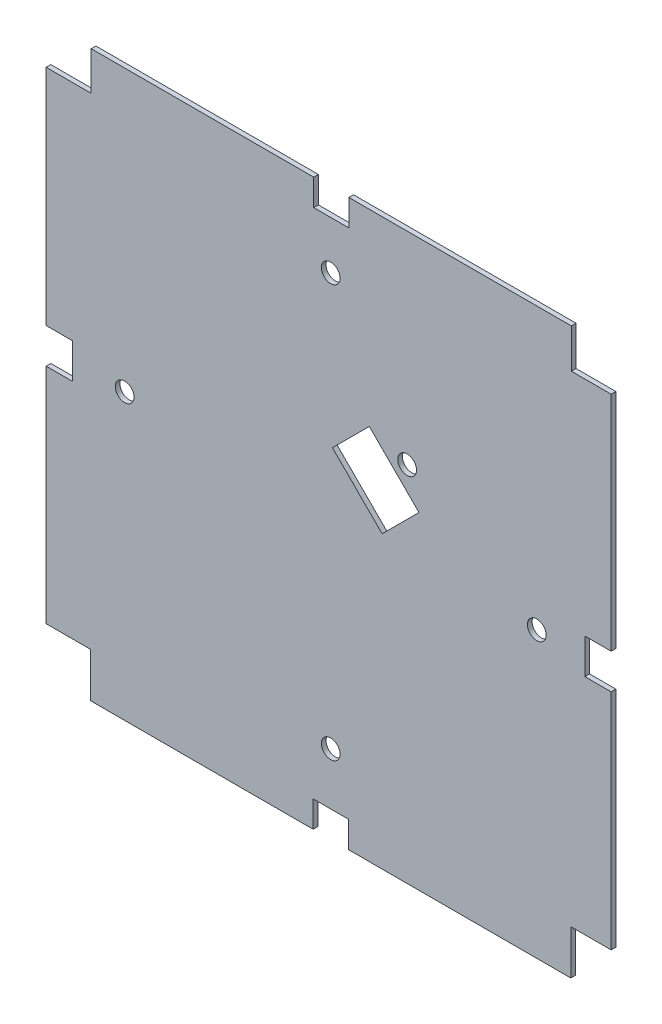
from build123d import *

# Parameters (mm, degrees)
SKETCH1_R           = 1.6
BOSS_EXTRUDE1_DEPTH = 0.8
CUT_EXTRUDE1_DEPTH  = 0.8


with BuildPart() as part:
    # Sketch1 → Boss-Extrude1 (new body)
    with BuildSketch(Plane.XY):
        Polygon((-21.328326925, 35.64702685), (-59.328326925, 35.64702685), (-59.328326925, 29.04702685), (-67.028326925, 29.04702685), (-67.028326925, -9.15297315), (-62.528326925, -9.15297315), (-62.528326925, -15.15297315), (-67.028326925, -15.15297315), (-67.028326925, -53.25297315), (-59.428326925, -53.25297315), (-59.428326925, -60.85297315), (-21.428326925, -60.85297315), (-21.428326925, -56.35297315), (-15.428326925, -56.35297315), (-15.428326925, -60.85297315), (22.571673075, -60.85297315), (22.571673075, -53.25297315), (29.471673075, -53.25297315), (29.471673075, -15.073036827), (24.971673075, -15.073036827), (24.971673075, -9.073036827), (29.471673075, -9.073036827), (29.471673075, 28.94702685), (22.671673075, 28.94702685), (22.671673075, 35.64702685), (-15.328326925, 35.64702685), (-15.328326925, 31.14702685), (-21.328326925, 31.14702685), align=None)
        with Locations((-18.428147066, -47.449600232)):
            Circle(SKETCH1_R, mode=Mode.SUBTRACT)
        with Locations((-53.624954006, -12.252793292)):
            Circle(SKETCH1_R, mode=Mode.SUBTRACT)
        with Locations((-5.370945752, 1.09702685)):
            Circle(SKETCH1_R, mode=Mode.SUBTRACT)
        with Locations((16.768659873, -12.252793292)):
            Circle(SKETCH1_R, mode=Mode.SUBTRACT)
        with Locations((-18.428147066, 22.944013647)):
            Circle(SKETCH1_R, mode=Mode.SUBTRACT)
    extrude(amount=BOSS_EXTRUDE1_DEPTH)

    # Sketch2 → Cut-Extrude1 (cut)
    with BuildSketch(Plane.XY.offset(0.8)):
        Polygon((-7.935255139, -9.545182739), (-16.420536513, -1.059901365), (-18.130934836, -2.770299688), (-9.645653462, -11.255581062), align=None)
        Polygon((-5.036117336, -6.646044936), (-13.52139871, 1.839236438), (-16.420536513, -1.059901365), (-7.935255139, -9.545182739), align=None)
        Polygon((-3.35240311, -4.96233071), (-11.837684484, 3.522950664), (-13.52139871, 1.839236438), (-5.036117336, -6.646044936), align=None)
    extrude(amount=-CUT_EXTRUDE1_DEPTH, mode=Mode.SUBTRACT)


solid = part.part
